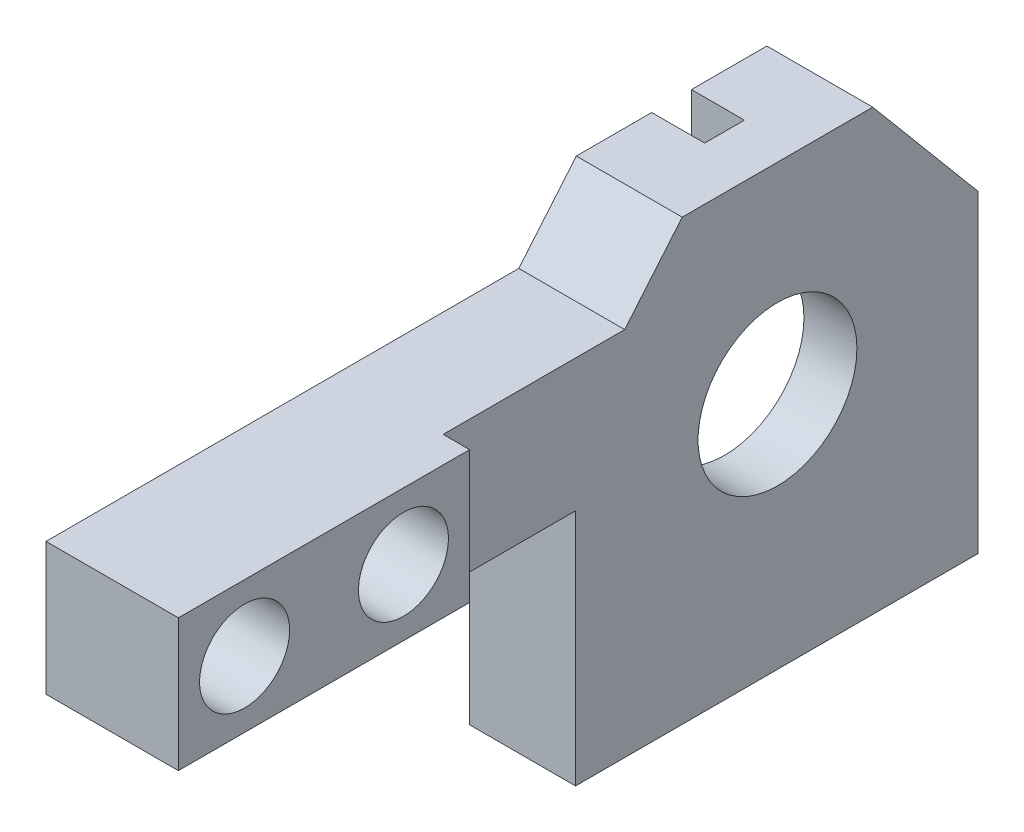
from build123d import *

# Parameters (mm, degrees)
BOSS_EXTRUDE1_DEPTH = 2
BOSS_EXTRUDE2_DEPTH = 2
SKETCH3_R           = 3
CUT_EXTRUDE1_DEPTH  = 2
SKETCH4_R           = 1.7
BOSS_EXTRUDE3_DEPTH = 5
CUT_EXTRUDE2_DEPTH  = 1


with BuildPart() as part:
    # Sketch2 → Boss-Extrude1 (new body)
    with BuildSketch(Plane(origin=(0, 0, 0), x_dir=(0, 0, -1), z_dir=(1, 0, 0))):
        Polygon((-8.109308511, -7.091340238), (-8.109308511, 4.696600231), (-4.079902129, 9.498659762), (3.11566899, 9.498659762), (7.090691489, 4.761412419), (7.090691489, -7.091340238), align=None)
    extrude(amount=-BOSS_EXTRUDE1_DEPTH)

    # Sketch1 → Boss-Extrude2 (add)
    with BuildSketch(Plane(origin=(0, 0, 0), x_dir=(0, 0, -1), z_dir=(1, 0, 0))):
        Polygon((-6.109308511, 3.968659762), (-3.147286813, 7.498659762), (-1.232116569, 7.498659762), (-1.232116569, 9.498659762), (-4.079902129, 9.498659762), (-8.109308511, 4.696600231), (-8.109308511, -7.091340238), (-3.982116569, -7.091340238), (-3.982116569, -5.091340238), (-6.109308511, -5.091340238), align=None)
        Polygon((5.090691489, 4.03347195), (5.090691489, -5.091340238), (3.017883431, -5.091340238), (3.017883431, -7.091340238), (7.090691489, -7.091340238), (7.090691489, 4.761412419), (3.11566899, 9.498659762), (0.267883431, 9.498659762), (0.267883431, 7.498659762), (2.183053674, 7.498659762), align=None)
    extrude(amount=BOSS_EXTRUDE2_DEPTH)

    # Sketch3 → Cut-Extrude1 (cut)
    with BuildSketch(Plane(origin=(0, 0, 0), x_dir=(0, 0, -1), z_dir=(1, 0, 0))):
        with Locations((-0.482116569, 1.908659762)):
            Circle(SKETCH3_R)
    extrude(amount=-CUT_EXTRUDE1_DEPTH, mode=Mode.SUBTRACT)

    # Sketch4 → Boss-Extrude3 (add)
    with BuildSketch(Plane(origin=(2, 0, 0), x_dir=(0, 0, -1), z_dir=(1, 0, 0))):
        Polygon((-15.482116569, 1.908659762), (-8.109308511, 1.908659762), (-8.109308511, 4.696600231), (-6.253170174, 6.908659762), (-20.486049047, 6.908659762), (-24.109308511, 6.908659762), (-24.109308511, 1.908659762), align=None)
        with Locations((-15.609308511, 4.408659762)):
            Circle(SKETCH4_R, mode=Mode.SUBTRACT)
        with Locations((-21.609308511, 4.408659762)):
            Circle(SKETCH4_R, mode=Mode.SUBTRACT)
    extrude(amount=-BOSS_EXTRUDE3_DEPTH)

    # Sketch5 → Cut-Extrude2 (cut)
    with BuildSketch(Plane.ZY.offset(3)):
        Polygon((8.109308511, 6.908659762), (6.253170174, 6.908659762), (8.109308511, 4.696600231), (8.109308511, 1.908659762), (13.109308511, 1.908659762), (13.109308511, 6.908659762), align=None)
    extrude(amount=-CUT_EXTRUDE2_DEPTH, mode=Mode.SUBTRACT)


with BuildPart() as body_2:
    # Mirror1: mirrored copy
    add(part.part.mirror(Plane(origin=(0, 0, 0), x_dir=(0, 0, 1), z_dir=(1, 0, 0))))


solid = body_2.part
